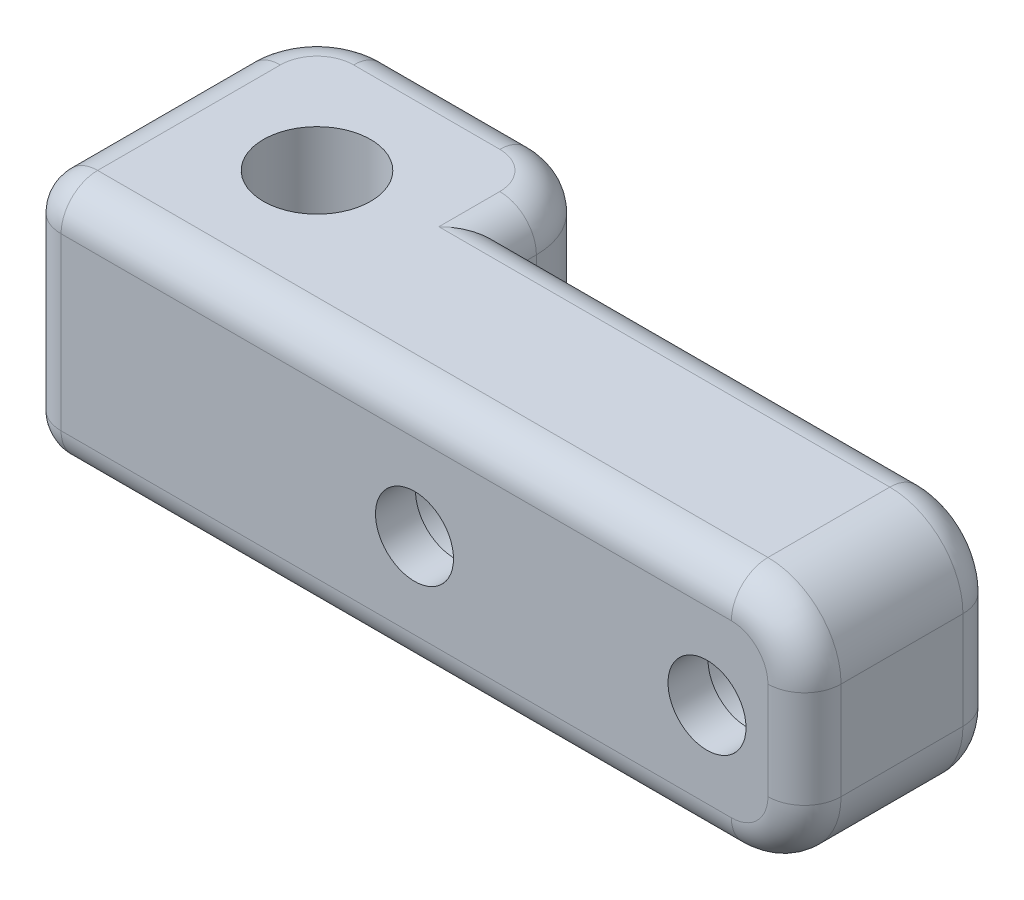
from build123d import *

# Parameters (mm, degrees)
SKETCH1_W                      = 12
SKETCH1_H                      = 12
BOSS_EXTRUDE1_DEPTH            = 10
SKETCH3_W                      = 8
SKETCH3_H                      = 10
BOSS_EXTRUDE3_DEPTH            = 20
M3_CLEARANCE_HOLE1_D           = 3.2
FILLET3_R                      = 3
F_4_4_4_4_DIAMETER_HOLE1_D     = 4.4
F_4_4_4_4_DIAMETER_HOLE1_DEPTH = 6
F_4_4_4_4_DIAMETER_HOLE1_TIP   = 1.321893362
FILLET4_R                      = 1.5
HOLE1_D                        = 3.2
HOLE1_DEPTH                    = 100
HOLE1_CBORE_D                  = 4.4
HOLE1_CBORE_DEPTH              = 6


with BuildPart() as part:
    # Sketch1 → Boss-Extrude1 (new body)
    with BuildSketch(Plane(origin=(0, 0, 0), x_dir=(1, 0, 0), z_dir=(0, 1, 0))):
        with Locations((6, 6)):
            Rectangle(SKETCH1_W, SKETCH1_H)
    extrude(amount=BOSS_EXTRUDE1_DEPTH)

    # Sketch3 → Boss-Extrude3 (add)
    with BuildSketch(Plane(origin=(12, 0, 0), x_dir=(0, 0, -1), z_dir=(1, 0, 0))):
        with Locations((4, 5)):
            Rectangle(SKETCH3_W, SKETCH3_H)
    extrude(amount=BOSS_EXTRUDE3_DEPTH)

    # M3 Clearance Hole1 (through all)
    with Locations(Plane.XY):
        with Locations((16, 5), (28, 5)):
            Hole(M3_CLEARANCE_HOLE1_D / 2)

    # Fillet3
    fillet3_edges = [part.edges().sort_by_distance(p)[0] for p in [
        (32, 0, -4),
        (32, 10, -4),
        (0, 5, -12),
        (12, 5, -12),
    ]]
    fillet(fillet3_edges, radius=FILLET3_R)

    # Ø4.4 (4.4) Diameter Hole1
    with Locations(Plane(origin=(0, 0, -8), x_dir=(-1, 0, 0), z_dir=(0, 0, -1))):
        with Locations((-28, 5), (-16, 5)):
            Hole(F_4_4_4_4_DIAMETER_HOLE1_D / 2, depth=F_4_4_4_4_DIAMETER_HOLE1_DEPTH)
            with Locations((0, 0, -(F_4_4_4_4_DIAMETER_HOLE1_DEPTH + F_4_4_4_4_DIAMETER_HOLE1_TIP / 2))):  # 118° drill point
                Cone(0, F_4_4_4_4_DIAMETER_HOLE1_D / 2, F_4_4_4_4_DIAMETER_HOLE1_TIP, mode=Mode.SUBTRACT)

    # Fillet4
    fillet4_edges = [part.edges().sort_by_distance(p)[0] for p in [
        (12, 0, -8.5),
        (12, 10, -8.5),
        (0, 0, -4.5),
        (0, 10, -4.5),
        (6, 0, -12),
        (20.5, 0, -8),
        (11.121320344, 0, -11.121320344),
        (0.878679656, 0, -11.121320344),
        (6, 10, -12),
        (20.5, 10, -8),
        (11.121320344, 10, -11.121320344),
        (0.878679656, 10, -11.121320344),
        (32, 5, 0),
        (32, 5, -8),
        (31.121320344, 9.121320344, -8),
        (31.121320344, 0.878679656, -8),
        (31.121320344, 9.121320344, 0),
        (31.121320344, 0.878679656, 0),
        (14.5, 0, 0),
        (0, 5, 0),
        (14.5, 10, 0),
    ]]
    fillet(fillet4_edges, radius=FILLET4_R)

    # Hole1
    with Locations(Plane(origin=(0, 10, 0), x_dir=(1, 0, 0), z_dir=(0, 1, 0))):
        with Locations((6, 6)):
            CounterBoreHole(HOLE1_D / 2, HOLE1_CBORE_D / 2, HOLE1_CBORE_DEPTH, depth=HOLE1_DEPTH)


solid = part.part
